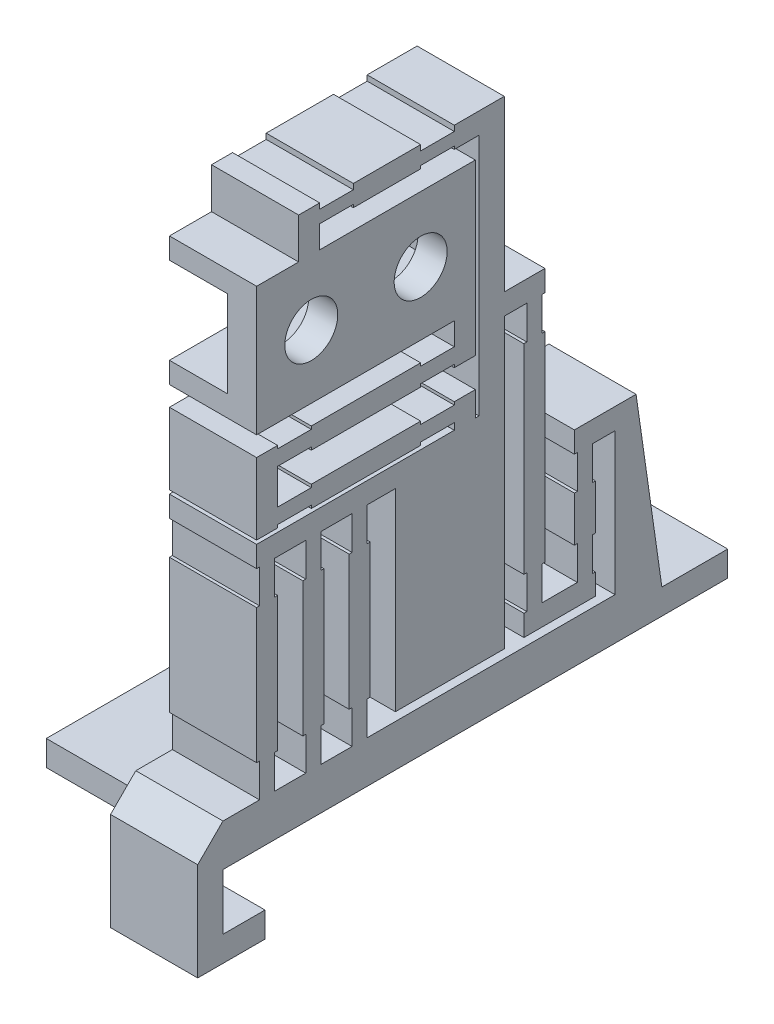
from build123d import *

# Parameters (mm, degrees)
BOSS_EXTRUDE1_DEPTH = 5.18
CUT_EXTRUDE4_REACH  = 42.076
SKETCH2_W           = 3.45
SKETCH2_H           = 5.15
CUT_EXTRUDE3_REACH  = 43.319
SKETCH7_R           = 1.575
SKETCH3_W           = 10.5
SKETCH3_H           = 30
SKETCH3_R           = 1.575
BOSS_EXTRUDE2_DEPTH = 1.5


with BuildPart() as part:
    # Sketch1 → Boss-Extrude1 (new body)
    with BuildSketch(Plane(origin=(0, 0, 0), x_dir=(0, 0, -1), z_dir=(1, 0, 0))):
        Polygon((2, 29.025), (2, 21.375), (13.75, 21.375), (13.75, 20.033333333), (11.75, 20.033333333), (11.75, 20.208333333), (5.25, 20.208333333), (5.25, 20.033333333), (3.25, 20.033333333), (3.25, 20.208333333), (2, 20.208333333), (2, 15.958333333), (3.25, 15.958333333), (3.25, 16.133333333), (5.25, 16.133333333), (5.25, 15.958333333), (11.75, 15.958333333), (11.75, 16.133333333), (13.75, 16.133333333), (13.75, 15.738333333), (2, 15.738333333), (2, 14.488333333), (2.175, 14.488333333), (2.175, 12.488333333), (2, 12.488333333), (2, 4.5), (2.175, 4.5), (2.175, 2.5), (0, 2.5), (-1.5, 1), (-1.5, -4.83), (2.5, -4.83), (2.5, -3.33), (0, -3.33), (0, 0), (26.303333333, 0), (24.553333333, 12.1875), (20.886666667, 12.1875), (20.886666667, 10.9375), (21.061666667, 10.9375), (21.061666667, 8.9375), (20.886666667, 8.9375), (20.886666667, 6.25), (21.061666667, 6.25), (21.061666667, 4.25), (18.961666667, 4.25), (18.961666667, 6.25), (19.136666667, 6.25), (19.136666667, 18.125), (18.961666667, 18.125), (18.961666667, 20.125), (19.136666667, 20.125), (19.136666667, 21.375), (16.72, 21.375), (16.72, 31.441666667), (13.75, 31.441666667), (13.75, 31.116666667), (11.75, 31.116666667), (11.75, 31.441666667), (7.75, 31.441666667), (7.75, 31.116666667), (5.75, 31.116666667), (5.75, 31.441666667), (4.5, 31.441666667), (4.5, 29.025), align=None)
        Polygon((5.75, 29.025), (15, 29.025), (15, 18.958333333), (13.75, 18.958333333), (13.75, 19.133333333), (11.75, 19.133333333), (11.75, 18.958333333), (5.25, 18.958333333), (5.25, 19.133333333), (3.25, 19.133333333), (3.25, 17.033333333), (5.25, 17.033333333), (5.25, 17.208333333), (11.75, 17.208333333), (11.75, 17.033333333), (13.75, 17.033333333), (13.75, 17.208333333), (15, 17.208333333), (15, 15.738333333), (15.22, 15.738333333), (15.22, 30.191666667), (13.75, 30.191666667), (13.75, 30.366666667), (11.75, 30.366666667), (11.75, 30.191666667), (7.75, 30.191666667), (7.75, 30.366666667), (5.75, 30.366666667), align=None, mode=Mode.SUBTRACT)
        Polygon((18.061666667, 4.25), (17.886666667, 4.25), (17.886666667, 3), (22.136666667, 3), (22.136666667, 4.25), (21.961666667, 4.25), (21.961666667, 6.25), (22.136666667, 6.25), (22.136666667, 8.9375), (21.961666667, 8.9375), (21.961666667, 10.9375), (23.303333333, 10.9375), (23.303333333, 2.5), (8.575, 2.5), (8.575, 4.5), (8.75, 4.5), (8.75, 12.488333333), (8.575, 12.488333333), (8.575, 14.488333333), (10.25, 14.488333333), (10.25, 3), (16.72, 3), (16.72, 20.125), (18.061666667, 20.125), (18.061666667, 18.125), (17.886666667, 18.125), (17.886666667, 6.25), (18.061666667, 6.25), align=None, mode=Mode.SUBTRACT)
        Polygon((3.075, 2.5), (3.075, 4.5), (3.25, 4.5), (3.25, 12.488333333), (3.075, 12.488333333), (3.075, 14.488333333), (4.925, 14.488333333), (4.925, 12.488333333), (4.75, 12.488333333), (4.75, 4.5), (4.925, 4.5), (4.925, 2.5), align=None, mode=Mode.SUBTRACT)
        Polygon((5.825, 2.5), (5.825, 4.5), (6, 4.5), (6, 12.488333333), (5.825, 12.488333333), (5.825, 14.488333333), (7.675, 14.488333333), (7.675, 12.488333333), (7.5, 12.488333333), (7.5, 4.5), (7.675, 4.5), (7.675, 2.5), align=None, mode=Mode.SUBTRACT)
    extrude(amount=BOSS_EXTRUDE1_DEPTH)

    # Sketch2 → Cut-Extrude4 (cut, up to next)
    with BuildSketch(Plane.XY.offset(-2), mode=Mode.PRIVATE) as cut_extrude4_sk1:
        with Locations((3.455, 25.2)):
            Rectangle(SKETCH2_W, SKETCH2_H)
    cut_extrude4_tool1 = extrude(cut_extrude4_sk1.sketch, amount=-CUT_EXTRUDE4_REACH, mode=Mode.PRIVATE) & part.part
    add(cut_extrude4_tool1.solids().sort_by_distance((3.455, 25.2, -2))[0], mode=Mode.SUBTRACT)

    # Sketch7 → Cut-Extrude3 (cut, up to next)
    with BuildSketch(Plane.ZY, mode=Mode.PRIVATE) as cut_extrude3_sk1:
        with Locations((-5.25, 25.15)):
            Circle(SKETCH7_R)
    cut_extrude3_tool1 = extrude(cut_extrude3_sk1.sketch, amount=-CUT_EXTRUDE3_REACH, mode=Mode.PRIVATE) & part.part
    # Sketch7 → Cut-Extrude3 (cut, up to next)
    with BuildSketch(Plane.ZY, mode=Mode.PRIVATE) as cut_extrude3_sk2:
        with Locations((-11.75, 25.15)):
            Circle(SKETCH7_R)
    cut_extrude3_tool2 = extrude(cut_extrude3_sk2.sketch, amount=-CUT_EXTRUDE3_REACH, mode=Mode.PRIVATE) & part.part
    add(cut_extrude3_tool1.solids().sort_by_distance((0, 25.15, -5.25))[0], mode=Mode.SUBTRACT)
    add(cut_extrude3_tool2.solids().sort_by_distance((0, 25.15, -11.75))[0], mode=Mode.SUBTRACT)

    # Sketch3 → Boss-Extrude2 (add)
    with BuildSketch(Plane.XZ):
        with Locations((5.25, -15)):
            Rectangle(SKETCH3_W, SKETCH3_H)
        with Locations(Location((7.62, -15.23, 0), (0, 0, 270))):
            Circle(SKETCH3_R, mode=Mode.SUBTRACT)
        with Locations(Location((7.62, -27.23, 0), (0, 0, 270))):
            Circle(SKETCH3_R, mode=Mode.SUBTRACT)
    extrude(amount=-BOSS_EXTRUDE2_DEPTH)


with BuildPart() as body_2:
    # Mirror1: mirrored copy
    add(part.part.mirror(Plane.ZY))


solid = body_2.part
